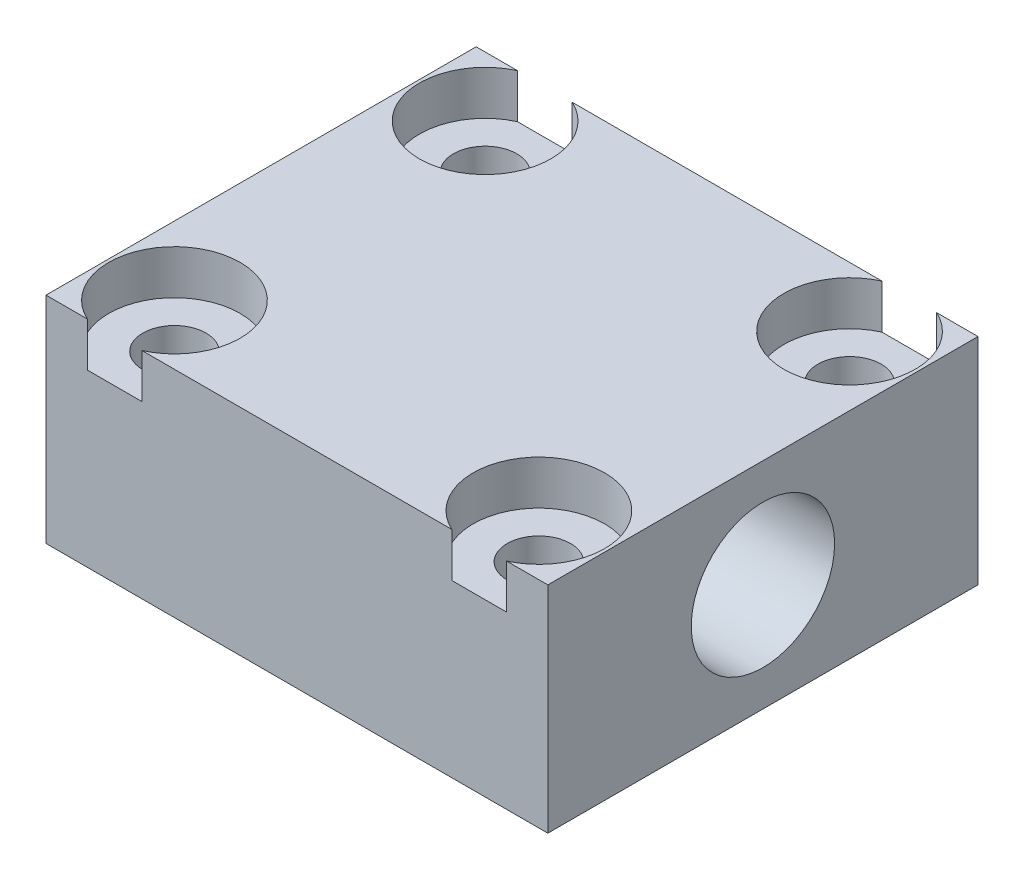
from build123d import *

# Parameters (mm, degrees)
SKETCH1_W                                        = 42
SKETCH1_H                                        = 36
BOSS_EXTRUDE1_DEPTH                              = 18
CBORE_FOR_M5_PAN_HEAD_MACHINE_SCREW3_D           = 5.3
CBORE_FOR_M5_PAN_HEAD_MACHINE_SCREW3_CBORE_D     = 11
CBORE_FOR_M5_PAN_HEAD_MACHINE_SCREW3_CBORE_DEPTH = 3.7
SKETCH7_R                                        = 6
CUT_EXTRUDE1_DEPTH                               = 50.112116631


with BuildPart() as part:
    # Sketch1 → Boss-Extrude1 (new body)
    with BuildSketch(Plane(origin=(0, 0, 0), x_dir=(1, 0, 0), z_dir=(0, 1, 0))):
        Rectangle(SKETCH1_W, SKETCH1_H)
    extrude(amount=BOSS_EXTRUDE1_DEPTH)

    # CBORE for M5 Pan Head Machine Screw3 (through all)
    with Locations(Plane(origin=(-6.549083899, 18, -3.689624732), x_dir=(-1, 0, 0), z_dir=(0, 1, 0))):
        with Locations((8.700916101, 16.689624732), (-21.799083899, 16.689624732), (-21.799083899, -9.310375268), (8.700916101, -9.310375268)):
            CounterBoreHole(CBORE_FOR_M5_PAN_HEAD_MACHINE_SCREW3_D / 2, CBORE_FOR_M5_PAN_HEAD_MACHINE_SCREW3_CBORE_D / 2, CBORE_FOR_M5_PAN_HEAD_MACHINE_SCREW3_CBORE_DEPTH)

    # Sketch7 → Cut-Extrude1 (cut, through all)
    with BuildSketch(Plane(origin=(21, 0, 0), x_dir=(0, 0, -1), z_dir=(1, 0, 0))):
        with Locations((0, 9)):
            Circle(SKETCH7_R)
    extrude(amount=-CUT_EXTRUDE1_DEPTH, mode=Mode.SUBTRACT)


solid = part.part
